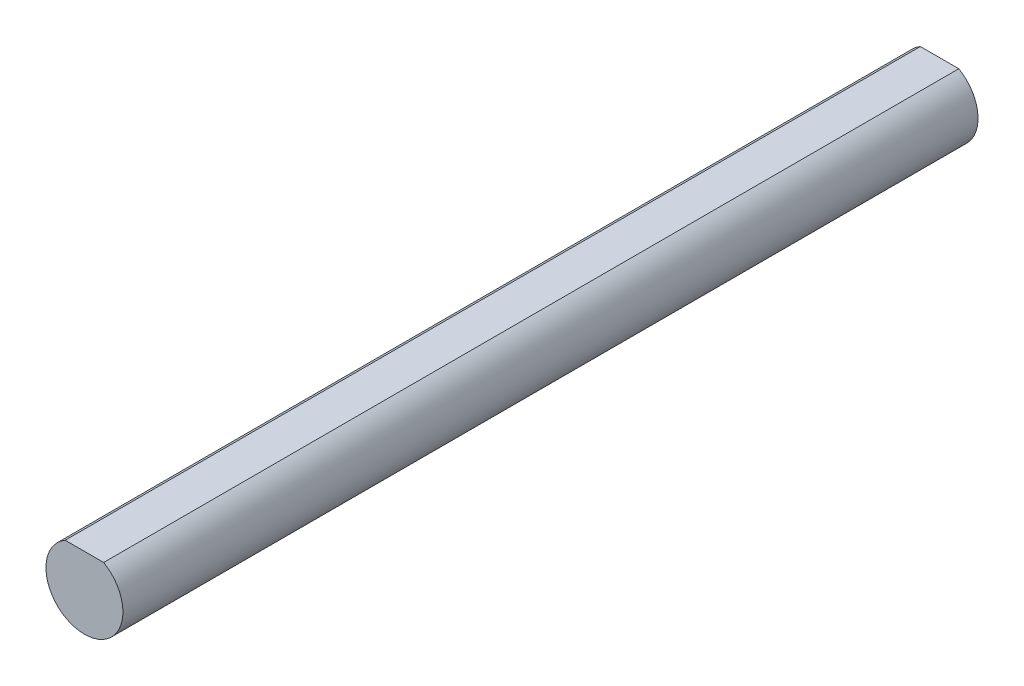
from build123d import *

# Parameters (mm, degrees)
SKETCH3_R               = 2
BOSS_EXTRUDE2_DEPTH     = 76.2
CUT_EXTRUDE5_DEPTH      = 77.25247537
CUT_EXTRUDE5_DEPTH_BACK = 77.25247537
CHAMFER1_SIZE           = 0.2
SKETCH11_R              = 3.175
CUT_EXTRUDE6_DEPTH      = 12.7
CUT_EXTRUDE7_START      = -19.05
SKETCH12_R              = 2
CUT_EXTRUDE7_DEPTH      = 19.05


with BuildPart() as part:
    # Sketch3 → Boss-Extrude2 (new body)
    with BuildSketch(Plane.XY):
        with Locations(Location((0, 0, 0), (0, 0, 180))):
            Circle(SKETCH3_R)
    extrude(amount=BOSS_EXTRUDE2_DEPTH)

    # Sketch10 → Cut-Extrude5 (cut, two sides: drawn at the far end of the back side and taken through both)
    with BuildSketch(Plane.XY.offset(-CUT_EXTRUDE5_DEPTH_BACK)):
        with BuildLine():
            Line((-1, 1.732050808), (1, 1.732050808))
            ThreePointArc((1, 1.732050808), (0, 2), (-1, 1.732050808))
        make_face()
    extrude(amount=CUT_EXTRUDE5_DEPTH + CUT_EXTRUDE5_DEPTH_BACK, mode=Mode.SUBTRACT)

    # Chamfer1
    chamfer1_edges = [part.edges().sort_by_distance(p)[0] for p in [
        (0, -2, 0),
        (0, -2, 76.2),
    ]]
    chamfer(chamfer1_edges, length=CHAMFER1_SIZE)

    # Sketch11 → Cut-Extrude6 (cut)
    with BuildSketch(Plane(origin=(0, 0, 0), x_dir=(-1, 0, 0), z_dir=(0, 0, -1))):
        Circle(SKETCH11_R)
    extrude(amount=-CUT_EXTRUDE6_DEPTH, mode=Mode.SUBTRACT)

    # Sketch12 → Cut-Extrude7 (cut)
    with BuildSketch(Plane.XY.offset(76.2).offset(CUT_EXTRUDE7_START)):
        Circle(SKETCH12_R)
    extrude(amount=CUT_EXTRUDE7_DEPTH, mode=Mode.SUBTRACT)


solid = part.part
